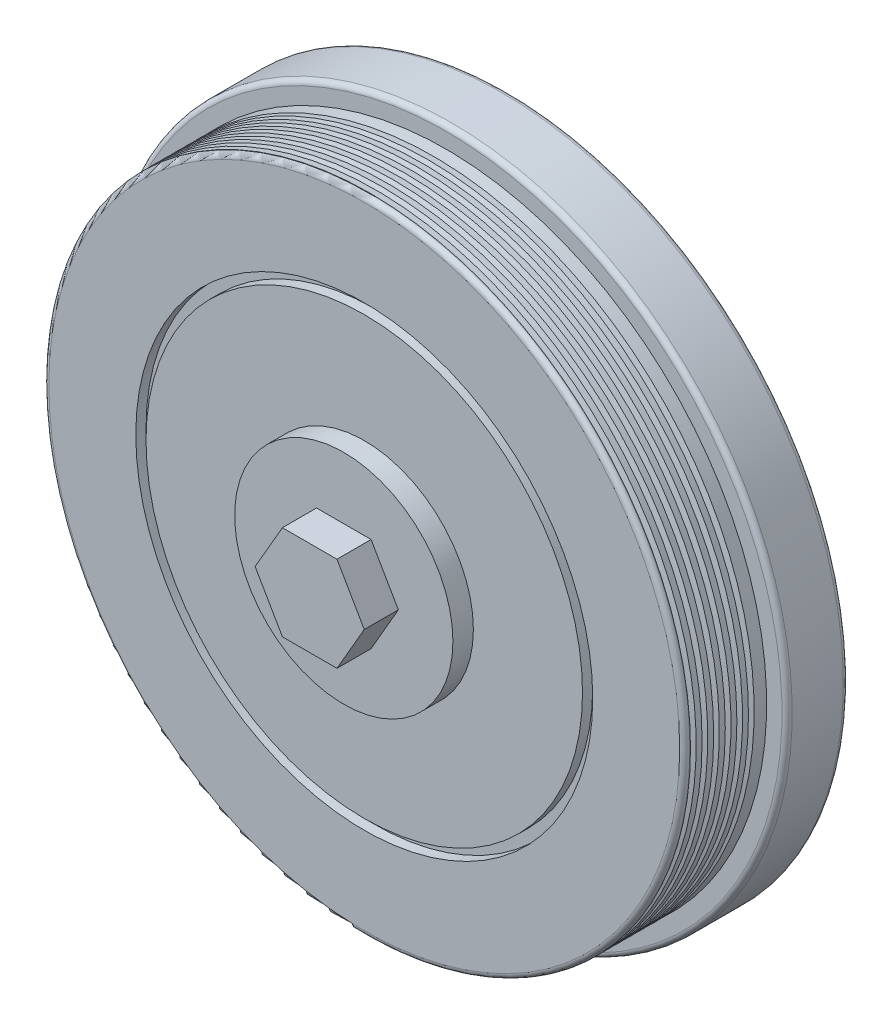
from build123d import *

# Parameters (mm, degrees)
SKETCH3_W        = 4
SKETCH3_H        = 3
WASHER_START     = 140
SKETCH4_R        = 32
WASHER_DEPTH     = 6
CRANK_START      = 146
CRANK_BOLT_DEPTH = 10


with BuildPart() as part:
    # Sketch1 → Balancer (revolve)
    with BuildSketch(Plane(origin=(0, 0, 0), x_dir=(0, 0, -1), z_dir=(1, 0, 0)), mode=Mode.PRIVATE) as balancer_sk:
        with BuildLine():
            Line((-98, 25.05), (-98, 98.5))
            ThreePointArc((-98, 98.5), (-98.439339828, 99.560660172), (-99.5, 100))
            Line((-99.5, 100), (-114.5, 100))
            ThreePointArc((-114.5, 100), (-115.560660172, 99.560660172), (-116, 98.5))
            Line((-116, 98.5), (-116, 94))
            Line((-116, 94), (-138.5, 94))
            ThreePointArc((-138.5, 94), (-139.560660172, 93.560660172), (-140, 92.5))
            Line((-140, 92.5), (-140, 25.05))
            Line((-140, 25.05), (-98, 25.05))
        make_face()
    revolve(balancer_sk.sketch.rotate(Axis((0, 0, 80), (0, 0, 1)), 90), axis=Axis((0, 0, 80), (0, 0, 1)))

    # Sketch2 → Belt Grooves (revolve, cut)
    with BuildSketch(Plane(origin=(0, 0, 0), x_dir=(0, 0, -1), z_dir=(1, 0, 0)), mode=Mode.PRIVATE) as belt_grooves_sk:
        Polygon((-119, 96), (-120.5, 91.5), (-122, 96), align=None)
        Polygon((-122.4, 96), (-123.9, 91.5), (-125.4, 96), align=None)
        Polygon((-125.8, 96), (-127.3, 91.5), (-128.8, 96), align=None)
        Polygon((-129.2, 96), (-130.7, 91.5), (-132.2, 96), align=None)
        Polygon((-132.6, 96), (-134.1, 91.5), (-135.6, 96), align=None)
        Polygon((-136, 96), (-137.5, 91.5), (-139, 96), align=None)
    revolve(belt_grooves_sk.sketch.rotate(Axis((0, 0, 80), (0, 0, 1)), 90), axis=Axis((0, 0, 80), (0, 0, 1)), mode=Mode.SUBTRACT)

    # Sketch3 → Isolator Groove (revolve, cut)
    with BuildSketch(Plane(origin=(0, 0, 0), x_dir=(0, 0, -1), z_dir=(1, 0, 0)), mode=Mode.PRIVATE) as isolator_groove_sk:
        with Locations((-139, 65.5)):
            Rectangle(SKETCH3_W, SKETCH3_H)
    revolve(isolator_groove_sk.sketch.rotate(Axis((0, 0, 80), (0, 0, 1)), 90), axis=Axis((0, 0, 80), (0, 0, 1)), mode=Mode.SUBTRACT)

    # Sketch4 → Washer (add)
    with BuildSketch(Plane.XY.offset(WASHER_START)):
        Circle(SKETCH4_R)
    extrude(amount=WASHER_DEPTH)

    # Sketch5 → Crank Bolt (add)
    with BuildSketch(Plane.XY.offset(CRANK_START)):
        Polygon((16, 0), (8, 13.856406461), (-8, 13.856406461), (-16, 0), (-8, -13.856406461), (8, -13.856406461), align=None)
    extrude(amount=CRANK_BOLT_DEPTH)


solid = part.part
